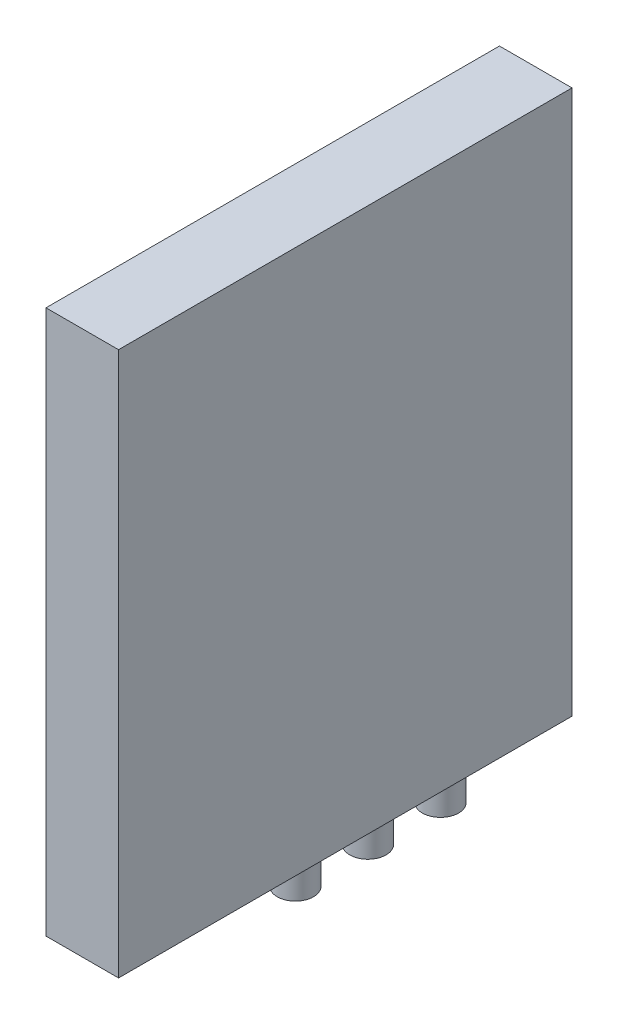
from build123d import *

# Parameters (mm, degrees)
SKETCH2_W           = 8
SKETCH2_H           = 50
SKETCH2_R           = 2.25
BOSS_EXTRUDE1_DEPTH = 60
SKETCH3_R           = 2
BOSS_EXTRUDE2_DEPTH = 5


with BuildPart() as part:
    # Sketch2 → Boss-Extrude1 (new body)
    # profile 1 of 4: a face of its own
    with BuildSketch(Plane(origin=(0, 0, 0), x_dir=(1, 0, 0), z_dir=(0, 1, 0))):
        with Locations((-19.731065886, 6.378485879)):
            Rectangle(SKETCH2_W, SKETCH2_H)
        with Locations((-19.731065886, 20.878485879)):
            Circle(SKETCH2_R, mode=Mode.SUBTRACT)
        with Locations((-19.731065886, 12.878485879)):
            Circle(SKETCH2_R, mode=Mode.SUBTRACT)
        with Locations((-19.731065886, 4.878485879)):
            Circle(SKETCH2_R, mode=Mode.SUBTRACT)
    # profile 2 of 4: a face of its own
    with BuildSketch(Plane(origin=(0, 0, 0), x_dir=(1, 0, 0), z_dir=(0, 1, 0))):
        with Locations((-19.731065886, 20.878485879)):
            Circle(SKETCH2_R)
    # profile 3 of 4: a face of its own
    with BuildSketch(Plane(origin=(0, 0, 0), x_dir=(1, 0, 0), z_dir=(0, 1, 0))):
        with Locations((-19.731065886, 12.878485879)):
            Circle(SKETCH2_R)
    # profile 4 of 4: a face of its own
    with BuildSketch(Plane(origin=(0, 0, 0), x_dir=(1, 0, 0), z_dir=(0, 1, 0))):
        with Locations((-19.731065886, 4.878485879)):
            Circle(SKETCH2_R)
    extrude(amount=BOSS_EXTRUDE1_DEPTH)

    # Sketch3 → Boss-Extrude2 (add)
    with BuildSketch(Plane.XZ):
        with Locations(Location((-19.731065886, -4.878485879, 0), (0, 0, 90))):
            Circle(SKETCH3_R)
        with Locations(Location((-19.731065886, -12.878485879, 0), (0, 0, 90))):
            Circle(SKETCH3_R)
        with Locations(Location((-19.731065886, -20.878485879, 0), (0, 0, 90))):
            Circle(SKETCH3_R)
    extrude(amount=BOSS_EXTRUDE2_DEPTH)


solid = part.part
